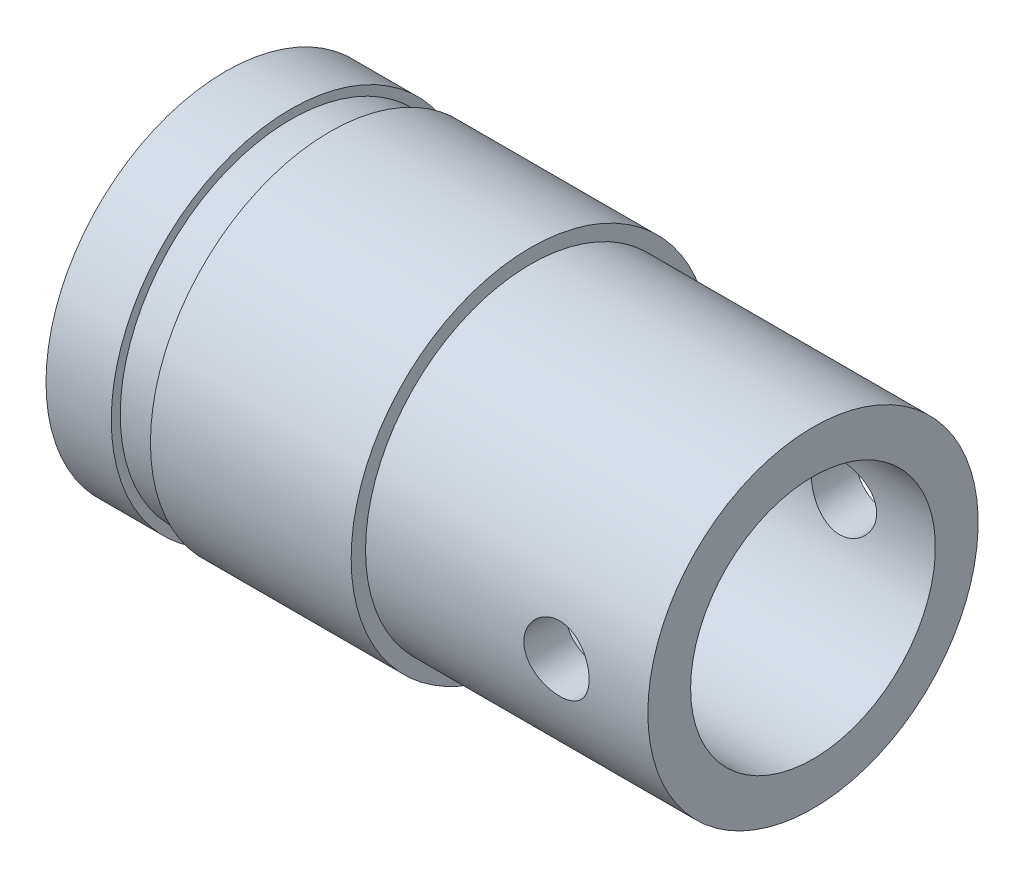
from build123d import *

# Parameters (mm, degrees)
ESBO_O2_R             = 1
CORTE_EXTRUS_O1_DEPTH = 10


with BuildPart() as part:
    # Esboço1 → Revolução1 (revolve)
    with BuildSketch(Plane.XY, mode=Mode.PRIVATE) as revolu_o1_sk:
        Polygon((0, 5.5), (2, 5.5), (2, 5.225), (3.2, 5.225), (3.2, 5.5), (9.35, 5.5), (9.35, 5.06), (18, 5.06), (18, 3.75), (6.1, 3.75), (6.1, 4.75), (0, 4.75), align=None)
    revolve(revolu_o1_sk.sketch.rotate(Axis((0, 0, 0), (1, 0, 0)), 90), axis=Axis((0, 0, 0), (1, 0, 0)))

    # Esboço2 → Corte-extrusão1 (cut, symmetric)
    with BuildSketch(Plane.XY):
        with Locations((15.2, 0)):
            Circle(ESBO_O2_R)
    extrude(amount=CORTE_EXTRUS_O1_DEPTH, both=True, mode=Mode.SUBTRACT)


solid = part.part
